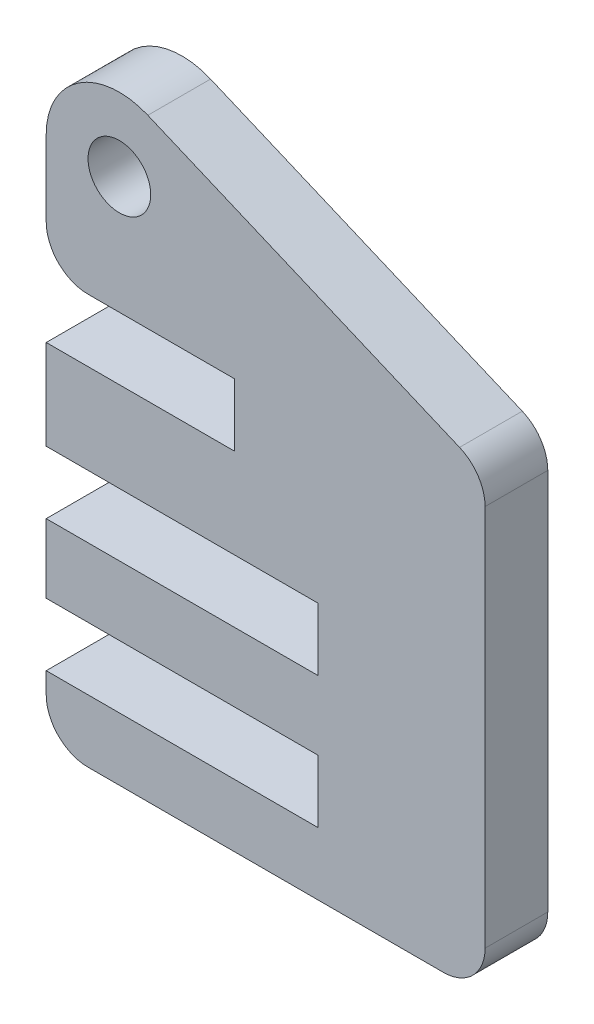
from build123d import *

# Parameters (mm, degrees)
BOSS_EXTRUDE1_DEPTH = 3
SKETCH4_W           = 13
SKETCH4_H           = 3
CUT_EXTRUDE1_DEPTH  = 3
SKETCH5_R           = 1.5
CUT_EXTRUDE2_DEPTH  = 3


with BuildPart() as part:
    # Sketch2 → Boss-Extrude1 (new body)
    with BuildSketch(Plane.XY):
        with BuildLine():
            Line((8.250612211, 16.791600065), (8.250612211, -1.508399935))
            ThreePointArc((8.250612211, -1.508399935), (7.664825773, -2.922613498), (6.250612211, -3.508399935))
            Line((6.250612211, -3.508399935), (-10.749387789, -3.508399935))
            ThreePointArc((-10.749387789, -3.508399935), (-12.163601352, -2.922613498), (-12.749387789, -1.508399935))
            Line((-12.749387789, -1.508399935), (-12.749387789, 21.713833017))
            ThreePointArc((-12.749387789, 21.713833017), (-11.183455157, 24.630917763), (-7.886882979, 24.937740684))
            Line((-7.886882979, 24.937740684), (7.029186388, 18.633833017))
            ThreePointArc((7.029186388, 18.633833017), (7.91751778, 17.896781418), (8.250612211, 16.791600065))
        make_face()
    extrude(amount=BOSS_EXTRUDE1_DEPTH)

    # Sketch4 → Cut-Extrude1 (cut)
    with BuildSketch(Plane.XY.offset(3)):
        with BuildLine():
            Line((-12.749387789, 13.091600065), (-3.749387789, 13.091600065))
            Line((-3.749387789, 13.091600065), (-3.749387789, 16.091600065))
            Line((-3.749387789, 16.091600065), (-10.749387789, 16.091600065))
            ThreePointArc((-10.749387789, 16.091600065), (-12.163601352, 16.677386502), (-12.749387789, 18.091600065))
            Line((-12.749387789, 18.091600065), (-12.749387789, 13.091600065))
        make_face()
        with Locations((-6.249387789, 7.291600065)):
            Rectangle(SKETCH4_W, SKETCH4_H)
        with Locations((-6.249387789, 0.991600065)):
            Rectangle(SKETCH4_W, SKETCH4_H)
    extrude(amount=-CUT_EXTRUDE1_DEPTH, mode=Mode.SUBTRACT)

    # Sketch5 → Cut-Extrude2 (cut)
    with BuildSketch(Plane.XY.offset(3)):
        with Locations((-9.249387789, 21.713833017)):
            Circle(SKETCH5_R)
    extrude(amount=-CUT_EXTRUDE2_DEPTH, mode=Mode.SUBTRACT)


solid = part.part
